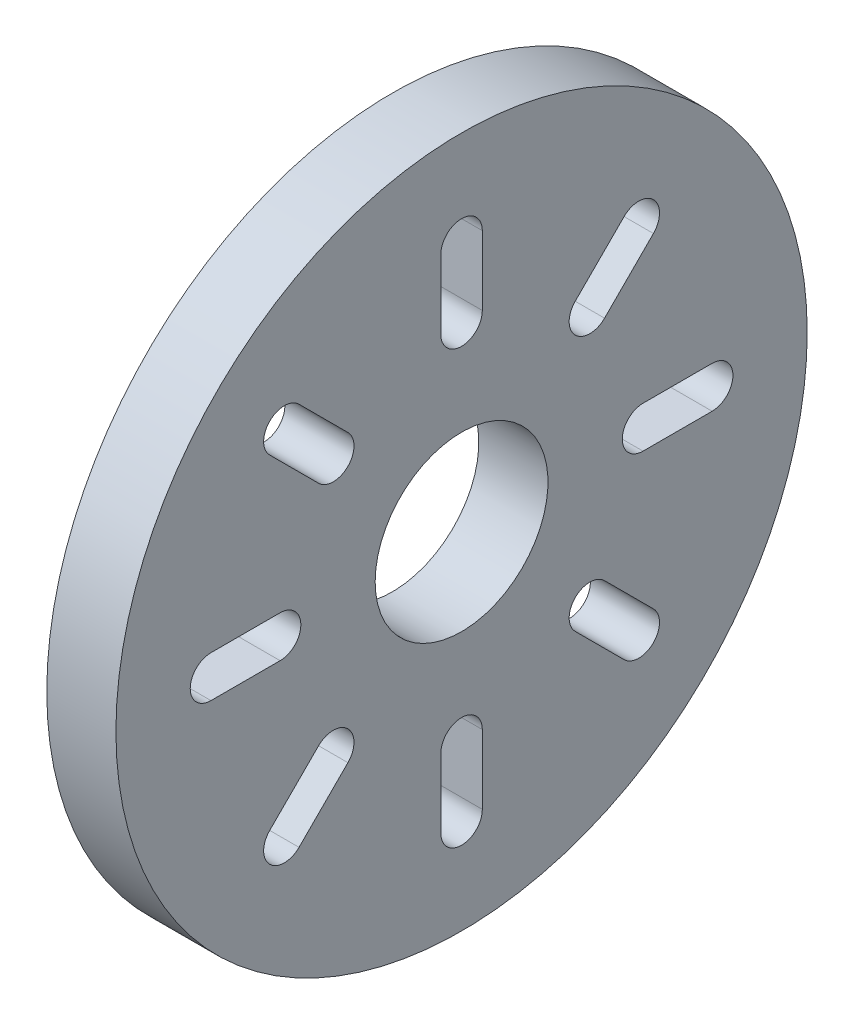
from build123d import *

# Parameters (mm, degrees)
SKETCH1_R             = 50
BOSS_EXTRUDE2_DEPTH   = 10
SKETCH1_4_OUTSIDE_W   = 130.354
SKETCH1_4_OUTSIDE_H   = 130.354
SKETCH1_4_OUTSIDE_R   = 50
SKETCH1_4_OUTSIDE_R_2 = 12.5
CUT_EXTRUDE2_DEPTH    = 13


with BuildPart() as part:
    # Sketch1 → Boss-Extrude2 (new body)
    with BuildSketch(Plane(origin=(0, 0, 0), x_dir=(0, 0, -1), z_dir=(1, 0, 0))):
        Circle(SKETCH1_R)
    extrude(amount=BOSS_EXTRUDE2_DEPTH)

    # Sketch1<4> outside → Cut-Extrude2 (cut)
    # profile 1 of 10: a face of its own
    with BuildSketch(Plane(origin=(0, 0, 0), x_dir=(0, 0, -1), z_dir=(1, 0, 0))):
        Rectangle(SKETCH1_4_OUTSIDE_W, SKETCH1_4_OUTSIDE_H)
        Circle(SKETCH1_4_OUTSIDE_R, mode=Mode.SUBTRACT)
    # profile 2 of 10: a face of its own
    with BuildSketch(Plane(origin=(0, 0, 0), x_dir=(0, 0, -1), z_dir=(1, 0, 0))):
        Circle(SKETCH1_4_OUTSIDE_R_2)
    # profile 3 of 10: a face of its own
    with BuildSketch(Plane(origin=(0, 0, 0), x_dir=(0, 0, -1), z_dir=(1, 0, 0))):
        with BuildLine():
            Line((3, 36.25), (3, 26.25))
            ThreePointArc((3, 26.25), (0, 23.25), (-3, 26.25))
            Line((-3, 26.25), (-3, 36.25))
            ThreePointArc((-3, 36.25), (0, 39.25), (3, 36.25))
        make_face()
    # profile 4 of 10: a face of its own
    with BuildSketch(Plane(origin=(0, 0, 0), x_dir=(0, 0, -1), z_dir=(1, 0, 0))):
        with BuildLine():
            Line((27.753941162, 23.511300474), (20.68287335, 16.440232663))
            ThreePointArc((20.68287335, 16.440232663), (16.440232663, 16.440232663), (16.440232663, 20.68287335))
            Line((16.440232663, 20.68287335), (23.511300474, 27.753941162))
            ThreePointArc((23.511300474, 27.753941162), (27.753941162, 27.753941162), (27.753941162, 23.511300474))
        make_face()
    # profile 5 of 10: a face of its own
    with BuildSketch(Plane(origin=(0, 0, 0), x_dir=(0, 0, -1), z_dir=(1, 0, 0))):
        with BuildLine():
            Line((36.25, -3), (26.25, -3))
            ThreePointArc((26.25, -3), (23.25, 0), (26.25, 3))
            Line((26.25, 3), (36.25, 3))
            ThreePointArc((36.25, 3), (39.25, 0), (36.25, -3))
        make_face()
    # profile 6 of 10: a face of its own
    with BuildSketch(Plane(origin=(0, 0, 0), x_dir=(0, 0, -1), z_dir=(1, 0, 0))):
        with BuildLine():
            Line((23.511300474, -27.753941162), (16.440232663, -20.68287335))
            ThreePointArc((16.440232663, -20.68287335), (16.440232663, -16.440232663), (20.68287335, -16.440232663))
            Line((20.68287335, -16.440232663), (27.753941162, -23.511300474))
            ThreePointArc((27.753941162, -23.511300474), (27.753941162, -27.753941162), (23.511300474, -27.753941162))
        make_face()
    # profile 7 of 10: a face of its own
    with BuildSketch(Plane(origin=(0, 0, 0), x_dir=(0, 0, -1), z_dir=(1, 0, 0))):
        with BuildLine():
            Line((-3, -36.25), (-3, -26.25))
            ThreePointArc((-3, -26.25), (0, -23.25), (3, -26.25))
            Line((3, -26.25), (3, -36.25))
            ThreePointArc((3, -36.25), (0, -39.25), (-3, -36.25))
        make_face()
    # profile 8 of 10: a face of its own
    with BuildSketch(Plane(origin=(0, 0, 0), x_dir=(0, 0, -1), z_dir=(1, 0, 0))):
        with BuildLine():
            Line((-27.753941162, -23.511300474), (-20.68287335, -16.440232663))
            ThreePointArc((-20.68287335, -16.440232663), (-16.440232663, -16.440232663), (-16.440232663, -20.68287335))
            Line((-16.440232663, -20.68287335), (-23.511300474, -27.753941162))
            ThreePointArc((-23.511300474, -27.753941162), (-27.753941162, -27.753941162), (-27.753941162, -23.511300474))
        make_face()
    # profile 9 of 10: a face of its own
    with BuildSketch(Plane(origin=(0, 0, 0), x_dir=(0, 0, -1), z_dir=(1, 0, 0))):
        with BuildLine():
            Line((-36.25, 3), (-26.25, 3))
            ThreePointArc((-26.25, 3), (-23.25, 0), (-26.25, -3))
            Line((-26.25, -3), (-36.25, -3))
            ThreePointArc((-36.25, -3), (-39.25, 0), (-36.25, 3))
        make_face()
    # profile 10 of 10: a face of its own
    with BuildSketch(Plane(origin=(0, 0, 0), x_dir=(0, 0, -1), z_dir=(1, 0, 0))):
        with BuildLine():
            Line((-23.511300474, 27.753941162), (-16.440232663, 20.68287335))
            ThreePointArc((-16.440232663, 20.68287335), (-16.440232663, 16.440232663), (-20.68287335, 16.440232663))
            Line((-20.68287335, 16.440232663), (-27.753941162, 23.511300474))
            ThreePointArc((-27.753941162, 23.511300474), (-27.753941162, 27.753941162), (-23.511300474, 27.753941162))
        make_face()
    extrude(amount=CUT_EXTRUDE2_DEPTH, mode=Mode.SUBTRACT)


solid = part.part
